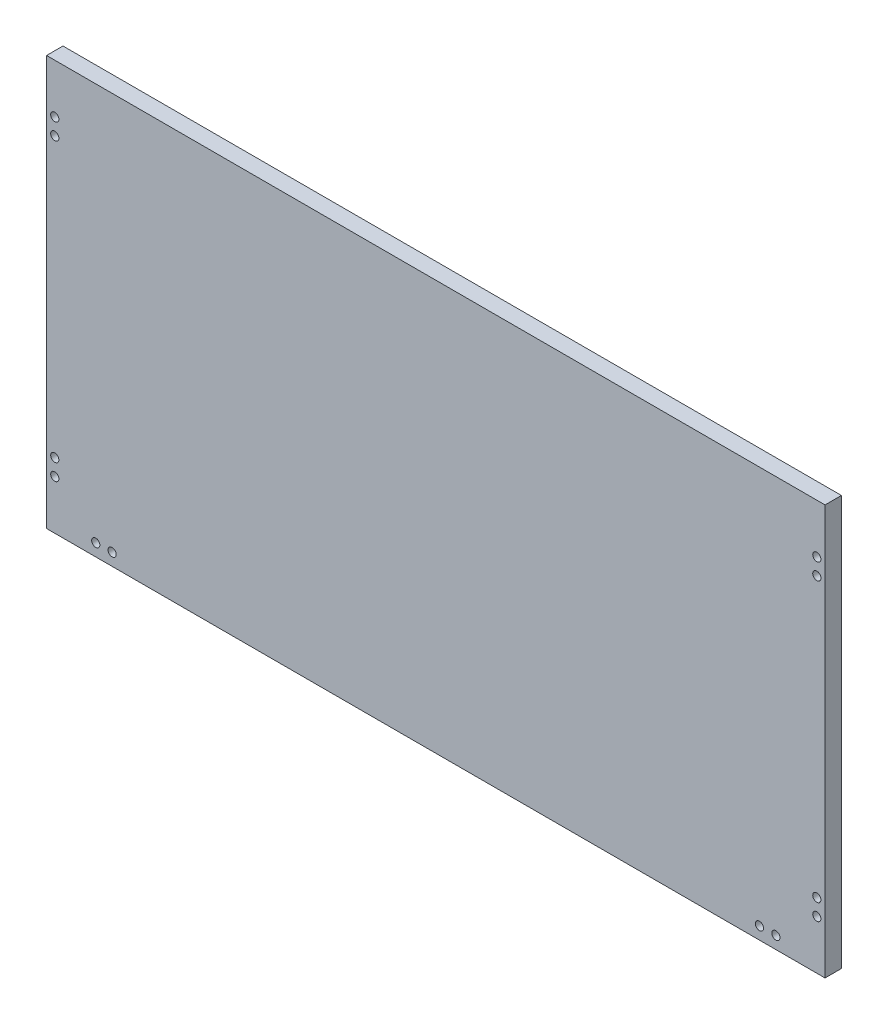
from build123d import *

# Parameters (mm, degrees)
SKETCH1_W           = 475
SKETCH1_H           = 250
BOSS_EXTRUDE1_DEPTH = 10
SKETCH2_R           = 2.5
CUT_EXTRUDE1_DEPTH  = 269.572615879


with BuildPart() as part:
    # Sketch1 → Boss-Extrude1 (new body)
    with BuildSketch(Plane.XY):
        Rectangle(SKETCH1_W, SKETCH1_H)
    extrude(amount=BOSS_EXTRUDE1_DEPTH)

    # Sketch2 → Cut-Extrude1 (cut, through all)
    with BuildSketch(Plane.XY.offset(10)):
        with Locations((-232.5, 95)):
            Circle(SKETCH2_R)
        with Locations((-232.5, 85)):
            Circle(SKETCH2_R)
        with Locations((-207.5, -117.5)):
            Circle(SKETCH2_R)
        with Locations((-197.5, -117.5)):
            Circle(SKETCH2_R)
        with Locations((197.5, -117.5)):
            Circle(SKETCH2_R)
        with Locations((207.5, -117.5)):
            Circle(SKETCH2_R)
        with Locations((232.5, 95)):
            Circle(SKETCH2_R)
        with Locations((232.5, 85)):
            Circle(SKETCH2_R)
        with Locations((232.5, -85)):
            Circle(SKETCH2_R)
        with Locations((232.5, -95)):
            Circle(SKETCH2_R)
        with Locations((-232.5, -85)):
            Circle(SKETCH2_R)
        with Locations((-232.5, -95)):
            Circle(SKETCH2_R)
    extrude(amount=-CUT_EXTRUDE1_DEPTH, mode=Mode.SUBTRACT)


solid = part.part
